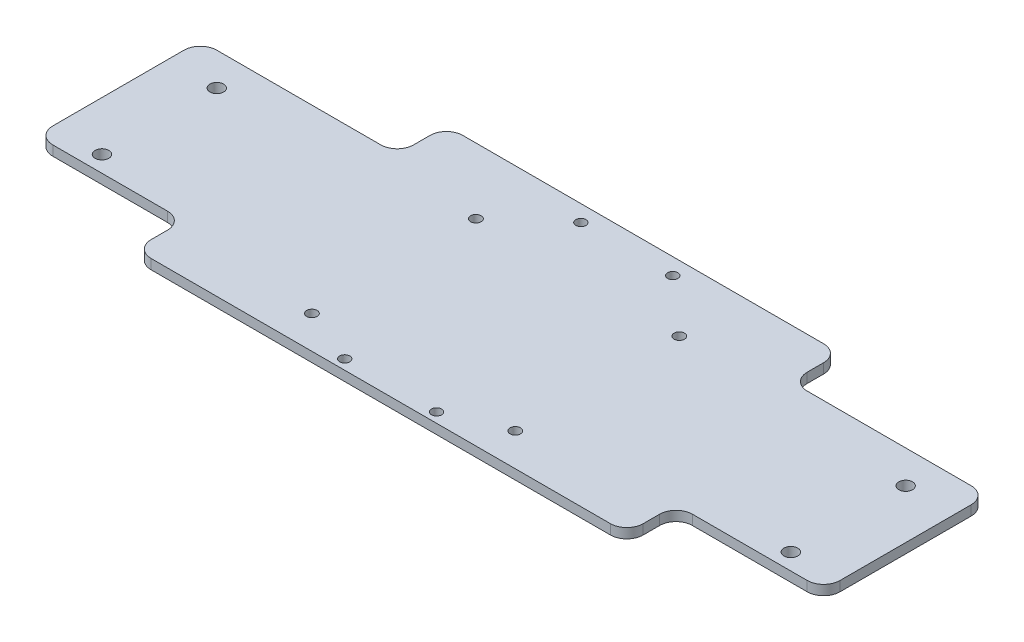
from build123d import *

# Parameters (mm, degrees)
SKETCH_1_W          = 240
SKETCH_1_H          = 65
SKETCH_1_R          = 2.1
SKETCH_1_W_2        = 120
SKETCH_1_H_2        = 15
EXTRUDE_1_DEPTH     = 3
SKETCH_3_R          = 1.6
SKETCH_3_R_2        = 1.55
SKETCH_3_W          = 45
SKETCH_3_H          = 15
CUT_EXTRUDE_2_DEPTH = 254
FILLET_1_R          = 5


with BuildPart() as part:
    # 草图1 → 凸台-拉伸1 (new body)
    # profile 1 of 2: a face of its own
    with BuildSketch(Plane(origin=(0, 0, 0), x_dir=(1, 0, 0), z_dir=(0, 1, 0))):
        with Locations((120, 32.5)):
            Rectangle(SKETCH_1_W, SKETCH_1_H)
        with Locations(Location((225, 20, 0), (0, 0, 270))):
            Circle(SKETCH_1_R, mode=Mode.SUBTRACT)
        with Locations(Location((15, 55, 0), (0, 0, 270))):
            Circle(SKETCH_1_R, mode=Mode.SUBTRACT)
        with Locations(Location((15, 20, 0), (0, 0, 270))):
            Circle(SKETCH_1_R, mode=Mode.SUBTRACT)
        with Locations(Location((225, 55, 0), (0, 0, 270))):
            Circle(SKETCH_1_R, mode=Mode.SUBTRACT)
    # profile 2 of 2: a face of its own
    with BuildSketch(Plane(origin=(0, 0, 0), x_dir=(1, 0, 0), z_dir=(0, 1, 0))):
        with Locations((120, 72.5)):
            Rectangle(SKETCH_1_W_2, SKETCH_1_H_2)
    extrude(amount=EXTRUDE_1_DEPTH)

    # 草图3 → 切除-拉伸2 (cut, through all)
    with BuildSketch(Plane.XZ):
        with Locations(Location((89, -10, 0), (0, 0, 270))):
            Circle(SKETCH_3_R)
        with Locations(Location((151, -10, 0), (0, 0, 90))):
            Circle(SKETCH_3_R)
        with Locations(Location((151, -60, 0), (0, 0, 270))):
            Circle(SKETCH_3_R)
        with Locations(Location((89, -60, 0), (0, 0, 90))):
            Circle(SKETCH_3_R)
        with Locations(Location((106, -3, 0), (0, 0, 270))):
            Circle(SKETCH_3_R_2)
        with Locations(Location((134, -3, 0), (0, 0, 90))):
            Circle(SKETCH_3_R_2)
        with Locations(Location((134, -75, 0), (0, 0, 270))):
            Circle(SKETCH_3_R_2)
        with Locations(Location((106, -75, 0), (0, 0, 90))):
            Circle(SKETCH_3_R_2)
        with Locations((22.5, -7.5)):
            Rectangle(SKETCH_3_W, SKETCH_3_H)
        with Locations((217.5, -7.5)):
            Rectangle(SKETCH_3_W, SKETCH_3_H)
    extrude(amount=-CUT_EXTRUDE_2_DEPTH, mode=Mode.SUBTRACT)

    # 圆角1
    fillet_1_edges = [part.edges().sort_by_distance(p)[0] for p in [
        (0, 1.5, -65),
        (60, 1.5, -65),
        (60, 1.5, -80),
        (180, 1.5, -80),
        (180, 1.5, -65),
        (240, 1.5, -65),
        (45, 1.5, 0),
        (45, 1.5, -15),
        (0, 1.5, -15),
        (240, 1.5, -15),
        (195, 1.5, -15),
        (195, 1.5, 0),
    ]]
    fillet(fillet_1_edges, radius=FILLET_1_R)


solid = part.part
